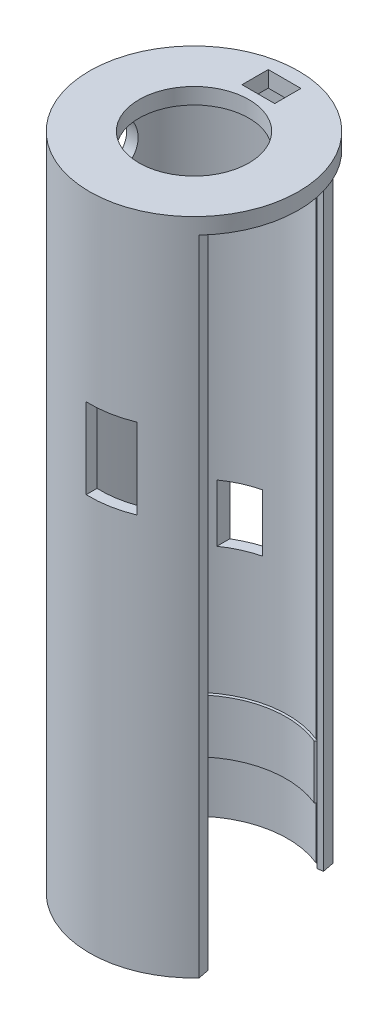
from build123d import *
from build123d.topology import SkipClean

# Parameters (mm, degrees)
BOSS_EXTRUDE1_DEPTH = 120
SKETCH13_R          = 19.5
SKETCH13_R_2        = 10.25
BOSS_EXTRUDE3_DEPTH = 3
SKETCH16_W          = 6.1
SKETCH16_H          = 4.9
CUT_EXTRUDE1_DEPTH  = 5
SKETCH17_W          = 8
SKETCH17_H          = 15
CUT_EXTRUDE2_DEPTH  = 150
SKETCH18_R          = 6
CUT_EXTRUDE5_DEPTH  = 20
SKETCH21_W          = 5.844351091
SKETCH21_H          = 10.714643668
CUT_EXTRUDE6_DEPTH  = 120
BOSS_EXTRUDE4_DEPTH = 10


with BuildPart() as part:
    # Sketch12 → Boss-Extrude1 (new body)
    with BuildSketch(Plane(origin=(0, 0, 0), x_dir=(1, 0, 0), z_dir=(0, 1, 0))):
        with BuildLine():
            Line((8.634693417, 15.51841097), (8.20840412, 17.688191027))
            ThreePointArc((8.20840412, 17.688191027), (-19.139762737, -3.730882249), (14.250877044, -13.310240549))
            Line((14.250877044, -13.310240549), (13.836638735, -11.183931196))
            Line((13.836638735, -11.183931196), (12.790172439, -11.44177067))
            Line((12.790172439, -11.44177067), (12.971781009, -12.381940525))
            Line((12.971781009, -12.381940525), (12.217996211, -12.500838715))
            ThreePointArc((12.217996211, -12.500838715), (-17.156357674, -3.348102652), (6.621374847, 16.1773853))
            Line((6.621374847, 16.1773853), (7.375159644, 16.345842711))
            Line((7.375159644, 16.345842711), (7.567993782, 15.364331637))
            Line((7.567993782, 15.364331637), (8.634693417, 15.51841097))
        make_face()
    extrude(amount=BOSS_EXTRUDE1_DEPTH)

    # Sketch13 → Boss-Extrude3 (add)
    with BuildSketch(Plane(origin=(0, 120, 0), x_dir=(1, 0, 0), z_dir=(0, 1, 0))):
        with Locations(Location((0, 0, 0), (0, 0, 65.10581206))):
            Circle(SKETCH13_R)
        with Locations(Location((0, 0, 0), (0, 0, 270))):
            Circle(SKETCH13_R_2, mode=Mode.SUBTRACT)
    extrude(amount=BOSS_EXTRUDE3_DEPTH)

    # Sketch16 → Cut-Extrude1 (cut)
    with BuildSketch(Plane(origin=(0, 123, 0), x_dir=(1, 0, 0), z_dir=(0, 1, 0))):
        with Locations((0, 14.45)):
            Rectangle(SKETCH16_W, SKETCH16_H)
    extrude(amount=-CUT_EXTRUDE1_DEPTH, mode=Mode.SUBTRACT)

    # Sketch17 → Cut-Extrude2 (cut)
    with BuildSketch(Plane.XY):
        with Locations((3.376565864, 81.232231727)):
            Rectangle(SKETCH17_W, SKETCH17_H)
    extrude(amount=CUT_EXTRUDE2_DEPTH, mode=Mode.SUBTRACT)

    # Sketch18 → Cut-Extrude5 (cut)
    with BuildSketch(Plane(origin=(0, 0, 0), x_dir=(0, 0, -1), z_dir=(1, 0, 0))):
        with Locations((0, 110.771126565)):
            Circle(SKETCH18_R)
    extrude(amount=-CUT_EXTRUDE5_DEPTH, mode=Mode.SUBTRACT)

    # Sketch21 → Cut-Extrude6 (cut)
    with BuildSketch(Plane.XY):
        with Locations((-7.11941315, 49.143528952)):
            Rectangle(SKETCH21_W, SKETCH21_H)
    extrude(amount=-CUT_EXTRUDE6_DEPTH, mode=Mode.SUBTRACT)

    # Sketch24 → Boss-Extrude4 (add)
    with SkipClean():  # the faces are left unmerged after this step: merging them gives an invalid solid
        with BuildSketch(Plane(origin=(0, 10, 0), x_dir=(-1, 0, 0), z_dir=(0, -1, 0))):
            with BuildLine():
                Line((-8.634693417, 15.51841097), (-7.567993782, 15.364331637))
                Line((-7.567993782, 15.364331637), (-7.375159644, 16.345842711))
                Line((-7.375159644, 16.345842711), (-6.711023244, 15.718008714))
                ThreePointArc((-6.711023244, 15.718008714), (16.685830266, -3.494713985), (-12.217996211, -12.500838715))
                Line((-12.217996211, -12.500838715), (-12.971781009, -12.381940525))
                Line((-12.971781009, -12.381940525), (-12.790172439, -11.44177067))
                Line((-12.790172439, -11.44177067), (-13.836638735, -11.183931196))
                Line((-13.836638735, -11.183931196), (-14.250877044, -13.310240549))
                ThreePointArc((-14.250877044, -13.310240549), (19.139762737, -3.730882249), (-8.20840412, 17.688191027))
                Line((-8.20840412, 17.688191027), (-8.634693417, 15.51841097))
            make_face()
        extrude(amount=-BOSS_EXTRUDE4_DEPTH)


solid = part.part
